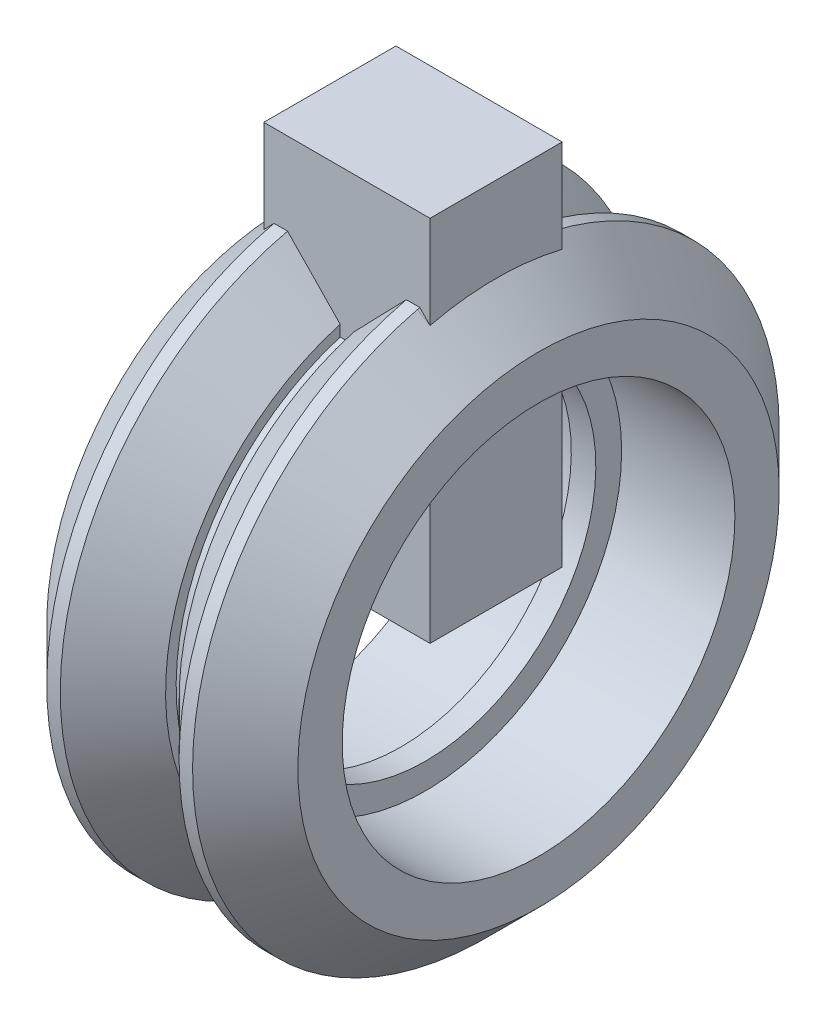
from build123d import *

# Parameters (mm, degrees)
SKETCH2_W           = 6.77241441
SKETCH2_H           = 5.383748994
BOSS_EXTRUDE1_DEPTH = 15


with BuildPart() as part:
    # Sketch1 → Revolve1 (revolve)
    with BuildSketch(Plane.XY, mode=Mode.PRIVATE) as revolve1_sk:
        Polygon((0.5, 6.95), (-0.5, 6.95), (-0.5, 8), (-5.115, 8), (-5.115, 9.805), (-2.97, 11.95), (-2.42, 11.95), (-0.275, 9.805), (-0.275, 9.375), (0.275, 9.375), (0.275, 9.805), (2.42, 11.95), (2.97, 11.95), (5.115, 9.805), (5.115, 8), (0.5, 8), align=None)
    revolve(revolve1_sk.sketch.rotate(Axis((0, 0, 0), (-1, 0, 0)), 90), axis=Axis((0, 0, 0), (-1, 0, 0)))

    # Sketch2 → Boss-Extrude1 (add)
    with BuildSketch(Plane(origin=(0, 0, 0), x_dir=(1, 0, 0), z_dir=(0, 1, 0))):
        Rectangle(SKETCH2_W, SKETCH2_H)
    extrude(amount=BOSS_EXTRUDE1_DEPTH)


solid = part.part
